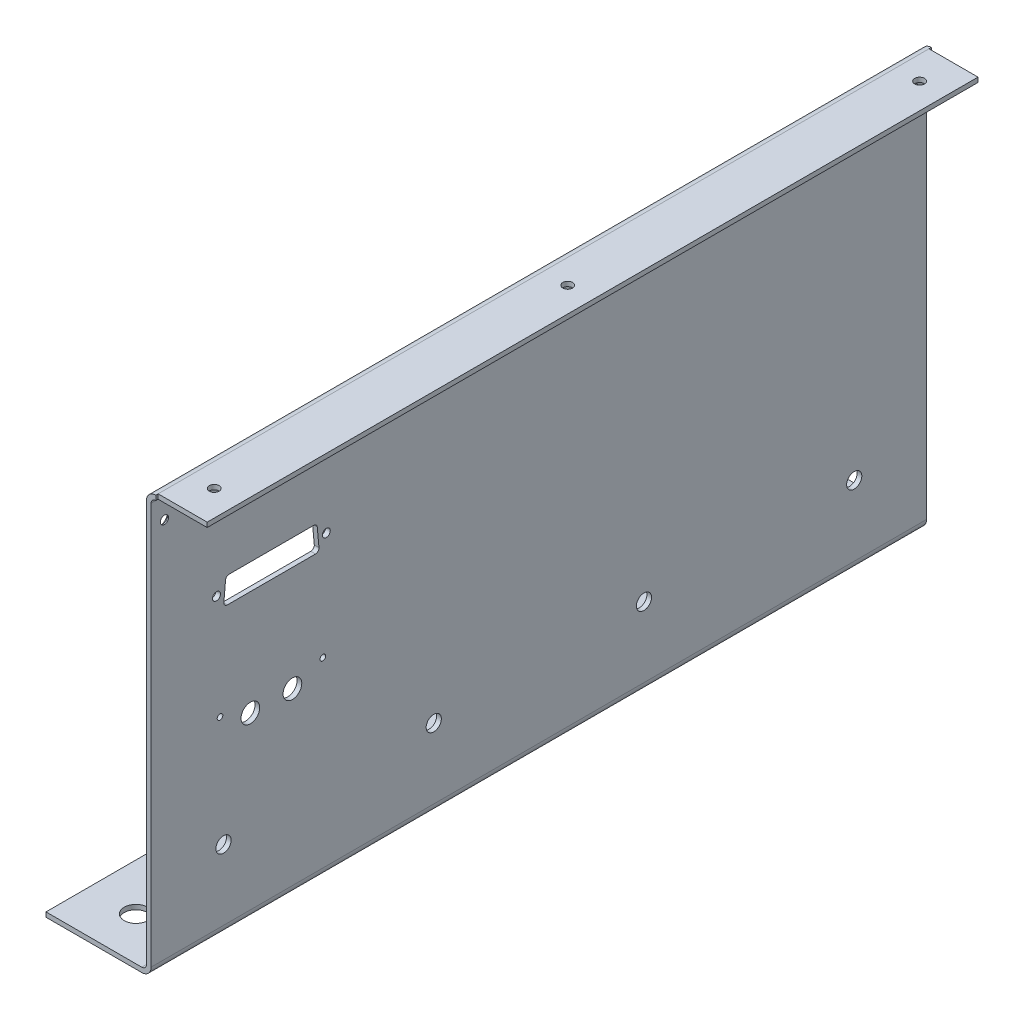
from build123d import *

# Parameters (mm, degrees)
EXTRUDE_1_DEPTH     = 332
SKETCH_2_R          = 3.25
CUT_EXTRUDE_1_DEPTH = 5
SKETCH_3_R          = 5
CUT_EXTRUDE_2_DEPTH = 5
SKETCH_4_W          = 26.179083289
SKETCH_4_H          = 3.25731829
CUT_EXTRUDE_3_DEPTH = 10
SKETCH_5_R          = 1.75
CUT_EXTRUDE_4_DEPTH = 2.5
CHAMFER_1_SIZE      = 1.5
SKETCH_6_R          = 1.7
SKETCH_6_R_2        = 1.2
SKETCH_6_R_3        = 4
CUT_EXTRUDE_5_DEPTH = 10
SKETCH_7_R          = 2.1
CUT_EXTRUDE_6_DEPTH = 10


with BuildPart() as part:
    # Эскиз1 → Вытянуть1 (new body)
    with BuildSketch(Plane.XY):
        with BuildLine():
            Line((-1, -68), (-1, 104))
            ThreePointArc((-1, 104), (0.171572875, 106.828427125), (3, 108))
            Line((3, 108), (24, 108))
            Line((24, 108), (24, 106))
            Line((24, 106), (3, 106))
            ThreePointArc((3, 106), (1.585786438, 105.414213562), (1, 104))
            Line((1, 104), (1, -68))
            ThreePointArc((1, -68), (-0.171572875, -70.828427125), (-3, -72))
            Line((-3, -72), (-44, -72))
            Line((-44, -72), (-44, -70))
            Line((-44, -70), (-3, -70))
            ThreePointArc((-3, -70), (-1.585786438, -69.414213562), (-1, -68))
        make_face()
    extrude(amount=EXTRUDE_1_DEPTH)

    # Эскиз2 → Вырез-Вытянуть1 (cut)
    with BuildSketch(Plane.ZY.offset(1)):
        with Locations((31, -38)):
            Circle(SKETCH_2_R)
        with Locations((121, -38)):
            Circle(SKETCH_2_R)
        with Locations((211, -38)):
            Circle(SKETCH_2_R)
        with Locations((301, -38)):
            Circle(SKETCH_2_R)
    extrude(amount=-CUT_EXTRUDE_1_DEPTH, mode=Mode.SUBTRACT)

    # Эскиз3 → Вырез-Вытянуть2 (cut)
    with BuildSketch(Plane(origin=(0, -70, 0), x_dir=(1, 0, 0), z_dir=(0, 1, 0))):
        with Locations(Location((-24, -18.5, 0), (0, 0, 270))):
            Circle(SKETCH_3_R)
        with Locations(Location((-24, -313.5, 0), (0, 0, 270))):
            Circle(SKETCH_3_R)
    extrude(amount=-CUT_EXTRUDE_2_DEPTH, mode=Mode.SUBTRACT)

    # Эскиз4 → Вырез-Вытянуть3 (cut)
    with BuildSketch(Plane(origin=(0, 108, 0), x_dir=(1, 0, 0), z_dir=(0, 1, 0))):
        with Locations((16.089541645, 0.628659145)):
            Rectangle(SKETCH_4_W, SKETCH_4_H)
        with Locations((16.089541645, -332.628659145)):
            Rectangle(SKETCH_4_W, SKETCH_4_H)
    extrude(amount=-CUT_EXTRUDE_3_DEPTH, mode=Mode.SUBTRACT)

    # Эскиз5 → Вырез-Вытянуть4 (cut)
    with BuildSketch(Plane.ZY.offset(1)):
        with Locations(Location((5.7, 95, 0), (0, 0, 270))):
            Circle(SKETCH_5_R)
        with Locations(Location((326.3, 95, 0), (0, 0, 270))):
            Circle(SKETCH_5_R)
    extrude(amount=-CUT_EXTRUDE_4_DEPTH, mode=Mode.SUBTRACT)

    # Фаска1
    chamfer_1_edges = [part.edges().sort_by_distance(p)[0] for p in [
        (-1, 96.75, 326.3),
        (-1, 96.75, 5.7),
    ]]
    chamfer(chamfer_1_edges, length=CHAMFER_1_SIZE)

    # Эскиз6 → Вырез-Вытянуть5 (cut)
    with BuildSketch(Plane.ZY.offset(1)):
        with Locations(Location((257, 55.5, 0), (0, 0, 270))):
            Circle(SKETCH_6_R)
        with Locations(Location((304, 55.5, 0), (0, 0, 270))):
            Circle(SKETCH_6_R)
        with Locations(Location((258.5, 10, 0), (0, 0, 270))):
            Circle(SKETCH_6_R_2)
        with Locations(Location((302.5, 10, 0), (0, 0, 270))):
            Circle(SKETCH_6_R_2)
        with Locations(Location((271.5, 5, 0), (0, 0, 270))):
            Circle(SKETCH_6_R_3)
        with Locations(Location((289.5, 5, 0), (0, 0, 270))):
            Circle(SKETCH_6_R_3)
        with BuildLine():
            Line((260.14870942, 51.635803619), (260.875982147, 59.635803619))
            ThreePointArc((260.875982147, 59.635803619), (261.358314525, 60.607633836), (262.369821957, 61))
            Line((262.369821957, 61), (298.630178043, 61))
            ThreePointArc((298.630178043, 61), (299.641685475, 60.607633836), (300.124017853, 59.635803619))
            Line((300.124017853, 59.635803619), (300.85129058, 51.635803619))
            ThreePointArc((300.85129058, 51.635803619), (300.465084606, 50.488492568), (299.35745077, 50))
            Line((299.35745077, 50), (261.64254923, 50))
            ThreePointArc((261.64254923, 50), (260.534915394, 50.488492568), (260.14870942, 51.635803619))
        make_face()
    extrude(amount=-CUT_EXTRUDE_5_DEPTH, mode=Mode.SUBTRACT)

    # Эскиз7 → Вырез-Вытянуть6 (cut)
    with BuildSketch(Plane(origin=(0, 108, 0), x_dir=(1, 0, 0), z_dir=(0, 1, 0))):
        with Locations(Location((13.353335267, -166, 0), (0, 0, 270))):
            Circle(SKETCH_7_R)
        with Locations(Location((13, -15, 0), (0, 0, 270))):
            Circle(SKETCH_7_R)
        with Locations(Location((13, -317, 0), (0, 0, 270))):
            Circle(SKETCH_7_R)
    extrude(amount=-CUT_EXTRUDE_6_DEPTH, mode=Mode.SUBTRACT)


solid = part.part
